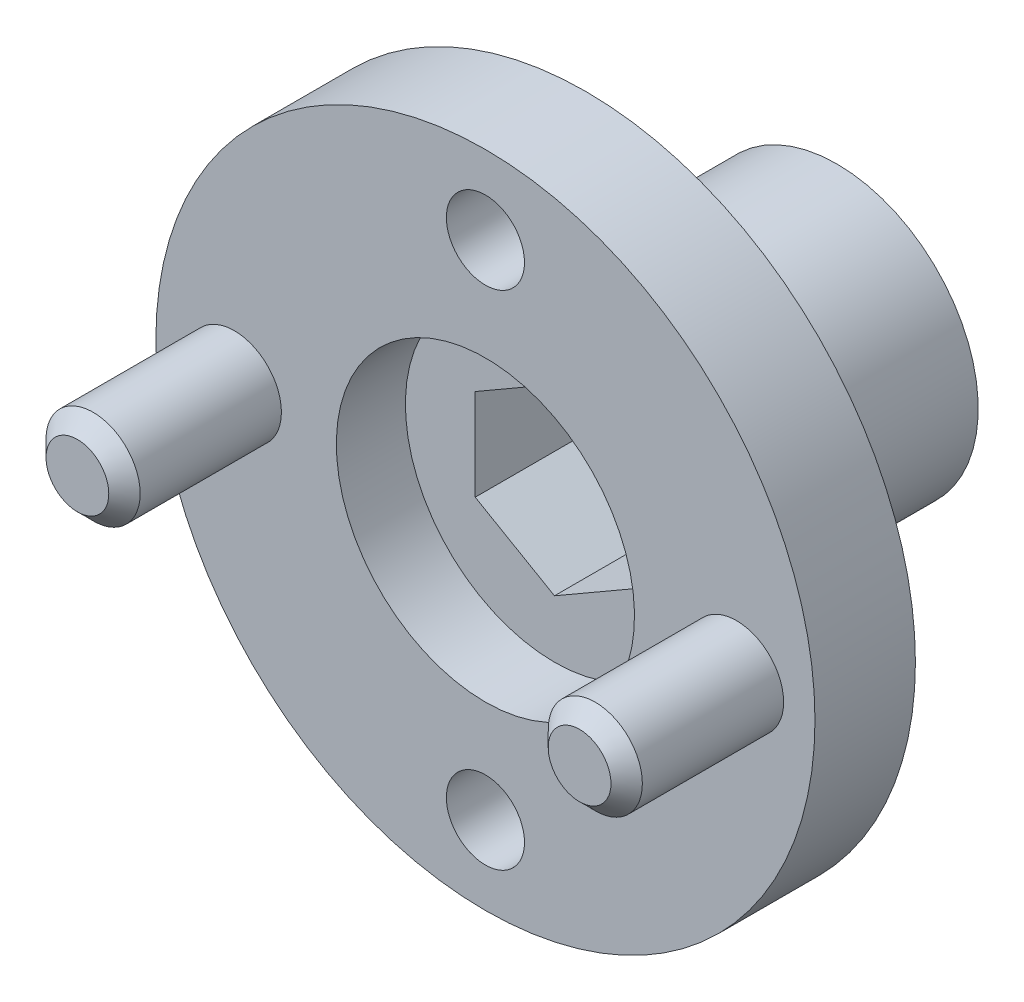
from build123d import *

# Parameters (mm, degrees)
SKETCH1_W                = 10.5
SKETCH1_H                = 3.2
SKETCH2_R                = 6
BOSS_EXTRUDE1_DEPTH      = 1
SKETCH3_R                = 4.5
BOSS_EXTRUDE2_DEPTH      = 7
CUT_EXTRUDE1_DEPTH       = 19.599462358
SKETCH5_W                = 2.2
SKETCH5_H                = 4.75
SKETCH6_W                = 1.5
SKETCH6_H                = 5
SKETCH7_W                = 1.5
SKETCH7_H                = 5
M2_CLEARANCE_HOLE1_D     = 2.49
M2_CLEARANCE_HOLE1_DEPTH = 11.2
CHAMFER1_SIZE            = 0.5


with BuildPart() as part:
    # Sketch1 → Revolve1 (revolve)
    with BuildSketch(Plane.XZ, mode=Mode.PRIVATE) as revolve1_sk:
        with Locations((5.25, -1.6)):
            Rectangle(SKETCH1_W, SKETCH1_H)
    revolve(revolve1_sk.sketch.rotate(Axis((0, 0, 0), (0, 0, -1)), 270), axis=Axis((0, 0, 0), (0, 0, -1)))

    # Sketch2 → Boss-Extrude1 (add)
    with BuildSketch(Plane(origin=(0, 0, -3.2), x_dir=(-1, 0, 0), z_dir=(0, 0, -1))):
        with Locations(Location((0, 0, 0), (0, 0, 90))):
            Circle(SKETCH2_R)
    extrude(amount=BOSS_EXTRUDE1_DEPTH)

    # Sketch3 → Boss-Extrude2 (add)
    with BuildSketch(Plane(origin=(0, 0, -4.2), x_dir=(-1, 0, 0), z_dir=(0, 0, -1))):
        with Locations(Location((0, 0, 0), (0, 0, 90))):
            Circle(SKETCH3_R)
    extrude(amount=BOSS_EXTRUDE2_DEPTH)

    # Sketch4 → Cut-Extrude1 (cut, through all)
    with BuildSketch(Plane.XY):
        Polygon((2.525, -1.45780943), (2.525, 1.45780943), (0, 2.915618859), (-2.525, 1.45780943), (-2.525, -1.45780943), (0, -2.915618859), align=None)
    extrude(amount=-CUT_EXTRUDE1_DEPTH, mode=Mode.SUBTRACT)

    # Sketch5 → Cut-Revolve1 (revolve, cut)
    with BuildSketch(Plane(origin=(0, 0, 0), x_dir=(0, 0, -1), z_dir=(1, 0, 0))):
        with Locations((1.1, -2.375)):
            Rectangle(SKETCH5_W, SKETCH5_H)
    revolve(axis=Axis((0, 0, -2.2), (0, 0, 1)), mode=Mode.SUBTRACT)

    # Sketch6 → Revolve2 (revolve)
    with BuildSketch(Plane(origin=(0, 0, 0), x_dir=(1, 0, 0), z_dir=(0, 1, 0))):
        with Locations((-7.25, -2.5)):
            Rectangle(SKETCH6_W, SKETCH6_H)
    revolve(axis=Axis((-8, 0, 0), (0, 0, 1)))

    # Sketch7 → Revolve3 (revolve)
    with BuildSketch(Plane(origin=(0, 0, 0), x_dir=(1, 0, 0), z_dir=(0, 1, 0))):
        with Locations((8.75, -2.5)):
            Rectangle(SKETCH7_W, SKETCH7_H)
    revolve(axis=Axis((8, 0, 0), (0, 0, 1)))

    # M2 Clearance Hole1
    with Locations(Plane.XY):
        with Locations((0, -8), (0, 8)):
            Hole(M2_CLEARANCE_HOLE1_D / 2, depth=M2_CLEARANCE_HOLE1_DEPTH)

    # Chamfer1
    chamfer1_edges = [part.edges().sort_by_distance(p)[0] for p in [
        (-9.5, 0, 5),
        (6.5, 0, 5),
    ]]
    chamfer(chamfer1_edges, length=CHAMFER1_SIZE)


solid = part.part
